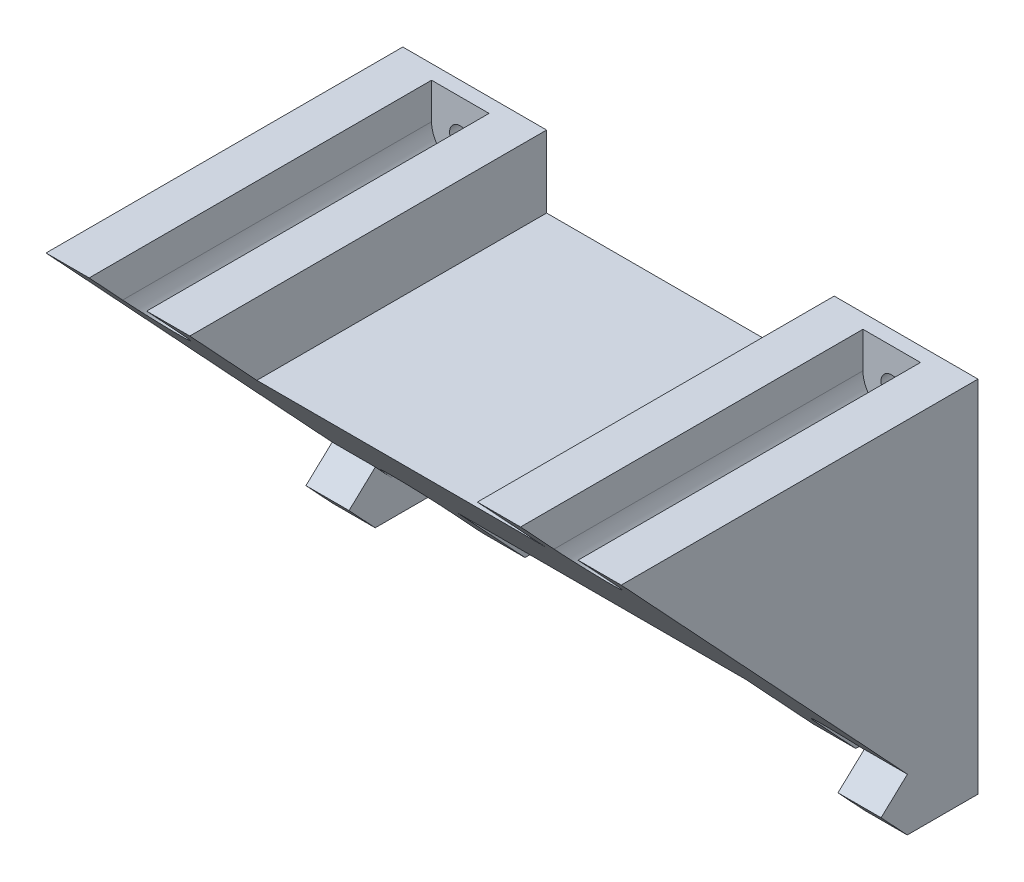
from build123d import *

# Parameters (mm, degrees)
EXTRUDE_2_DEPTH     = 2
SKETCH_3_R          = 1.5
CUT_EXTRUDE_1_DEPTH = 95.361008897
EXTRUDE_3_DEPTH     = 1
DRAFT_4_ANGLE       = 43
SKETCH_6_W          = 6
SKETCH_6_H          = 10
EXTRUDE_4_DEPTH     = 5
SKETCH_7_W          = 6
SKETCH_7_H          = 10
EXTRUDE_5_DEPTH     = 5
CUT_EXTRUDE_2_DEPTH = 107.596038813


with BuildPart() as part:
    # 草图1 → 凸台-拉伸2 (new body)
    with BuildSketch(Plane.XY):
        Polygon((0, 0), (0, 50), (20, 50), (20, 40), (60, 40), (60, 50), (80, 50), (80, 0), (60, 0), (60, 10), (20, 10), (20, 0), align=None)
    extrude(amount=EXTRUDE_2_DEPTH)

    # 草图3 → 切除-拉伸1 (cut, through all)
    with BuildSketch(Plane.XY.offset(2)):
        with Locations((10, 45)):
            Circle(SKETCH_3_R)
        with Locations((10, 5)):
            Circle(SKETCH_3_R)
        with Locations((70, 45)):
            Circle(SKETCH_3_R)
        with Locations((70, 5)):
            Circle(SKETCH_3_R)
    extrude(amount=-CUT_EXTRUDE_1_DEPTH, mode=Mode.SUBTRACT)

    # 草图5 → 凸台-拉伸3 (add)
    with BuildSketch(Plane.XY.offset(2)):
        with BuildLine():
            Line((0, 50), (6, 50))
            Line((6, 50), (6, 45))
            ThreePointArc((6, 45), (10, 41), (14, 45))
            Line((14, 45), (14, 50))
            Line((14, 50), (20, 50))
            Line((20, 50), (20, 40))
            Line((20, 40), (60, 40))
            Line((60, 40), (60, 50))
            Line((60, 50), (66, 50))
            Line((66, 50), (66, 45))
            ThreePointArc((66, 45), (70, 41), (74, 45))
            Line((74, 45), (74, 50))
            Line((74, 50), (80, 50))
            Line((80, 50), (80, 0))
            Line((80, 0), (74, 0))
            Line((74, 0), (74, 5))
            ThreePointArc((74, 5), (70, 9), (66, 5))
            Line((66, 5), (66, 0))
            Line((66, 0), (60, 0))
            Line((60, 0), (60, 10))
            Line((60, 10), (20, 10))
            Line((20, 10), (20, 0))
            Line((20, 0), (14, 0))
            Line((14, 0), (14, 5))
            ThreePointArc((14, 5), (10, 9), (6, 5))
            Line((6, 5), (6, 0))
            Line((6, 0), (0, 0))
            Line((0, 0), (0, 50))
        make_face()
    extrude(amount=EXTRUDE_3_DEPTH)

    # 拔模4
    draft_4_faces = [part.faces().sort_by_distance(p)[0] for p in [
        (40, 25, 3),
    ]]
    draft(draft_4_faces, Plane(origin=(20, 0, 2), x_dir=(-1, 0, 0), z_dir=(0, -1, 0)), DRAFT_4_ANGLE)

    # 草图6 → 凸台-拉伸4 (add)
    with BuildSketch(Plane(origin=(0, -1.496346075, 1.604634711), x_dir=(1, 0, 0), z_dir=(0, -0.6819983600624997, 0.7313537016191695))):
        with Locations((3, 7.04599508)):
            Rectangle(SKETCH_6_W, SKETCH_6_H)
    extrude(amount=EXTRUDE_4_DEPTH)

    # 草图7 → 凸台-拉伸5 (add)
    with BuildSketch(Plane(origin=(0, -1.496346075, 1.604634711), x_dir=(1, 0, 0), z_dir=(0, -0.6819983600624997, 0.7313537016191695))):
        with Locations((77, 7.04599508)):
            Rectangle(SKETCH_7_W, SKETCH_7_H)
    extrude(amount=EXTRUDE_5_DEPTH)

    # 草图8 → 切除-拉伸2 (cut, through all)
    with BuildSketch(Plane(origin=(80, 0, 0), x_dir=(0, 0, -1), z_dir=(1, 0, 0))):
        Polygon((-3, 0), (-9.836637305, 0), (-6.656768508, -3.4099918), align=None)
    extrude(amount=-CUT_EXTRUDE_2_DEPTH, mode=Mode.SUBTRACT)


solid = part.part
